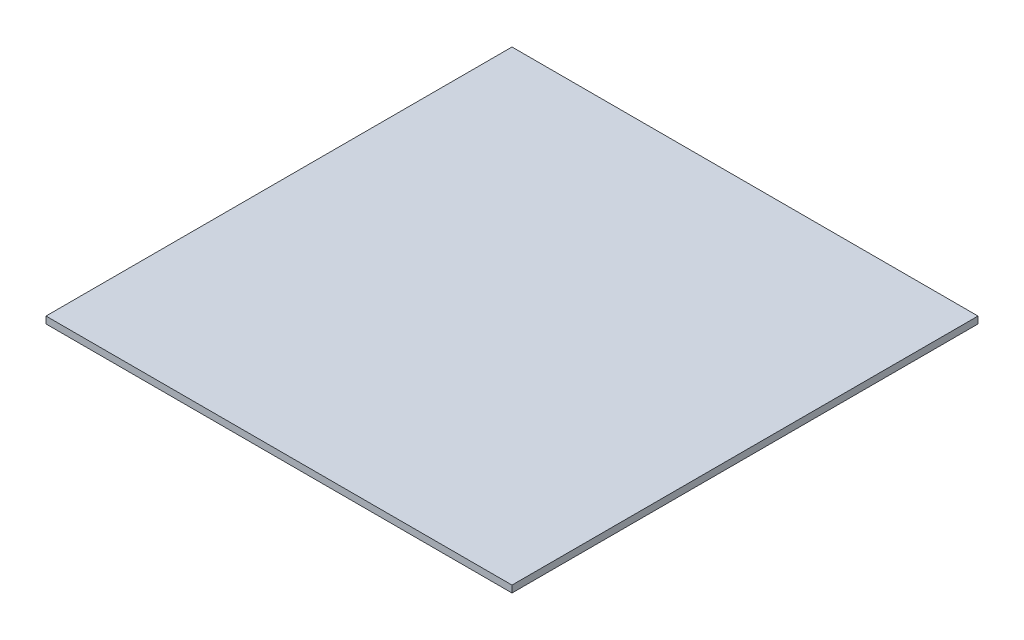
from build123d import *

# Parameters (mm, degrees)
SKETCH_1_W      = 203
SKETCH_1_H      = 203
EXTRUDE_1_DEPTH = 3


with BuildPart() as part:
    # 草图1 → 凸台-拉伸1 (new body)
    with BuildSketch(Plane(origin=(0, 0, 0), x_dir=(1, 0, 0), z_dir=(0, 1, 0))):
        Rectangle(SKETCH_1_W, SKETCH_1_H)
    extrude(amount=EXTRUDE_1_DEPTH)


solid = part.part
